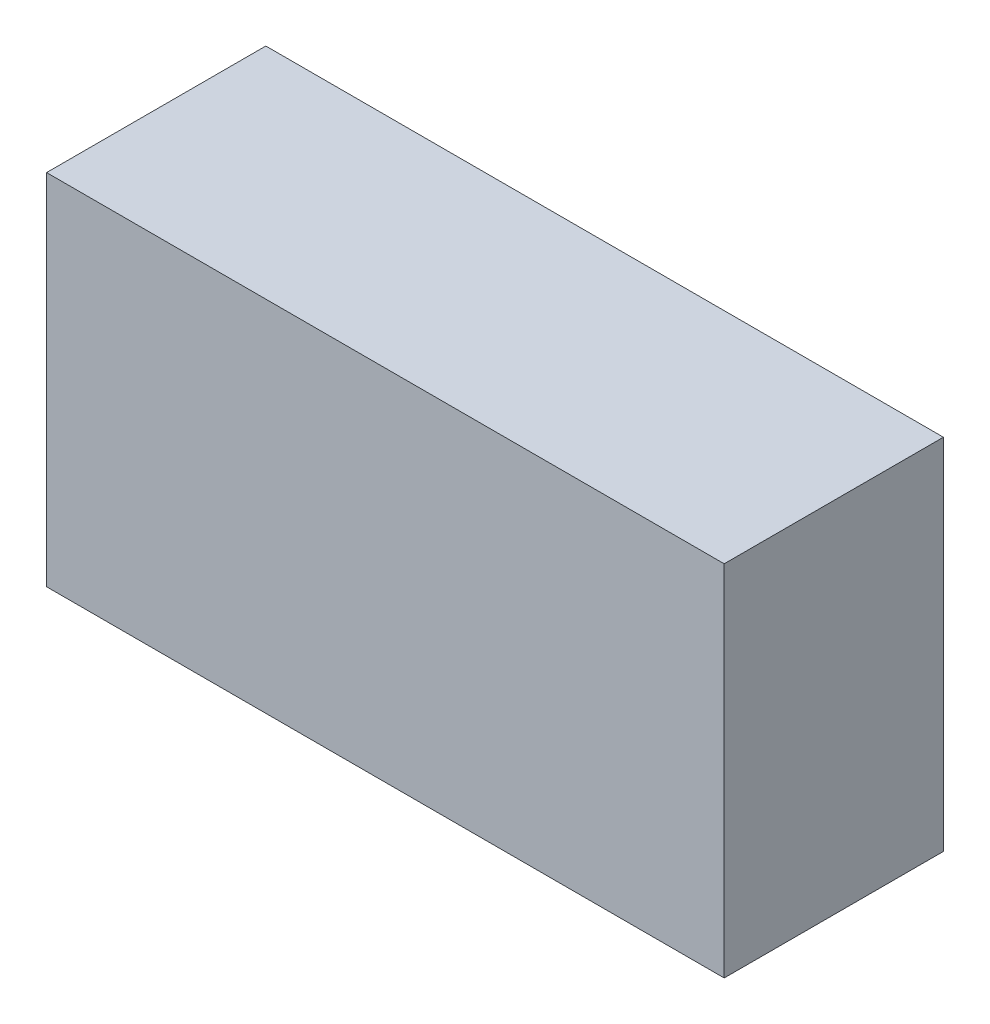
from build123d import *

# Parameters (mm, degrees)
SKETCH1_W           = 34
SKETCH1_H           = 18
BOSS_EXTRUDE1_DEPTH = 11


with BuildPart() as part:
    # Sketch1 → Boss-Extrude1 (new body)
    with BuildSketch(Plane.XY.offset(26)):
        with Locations((20, 14)):
            Rectangle(SKETCH1_W, SKETCH1_H)
    extrude(amount=BOSS_EXTRUDE1_DEPTH)


solid = part.part
